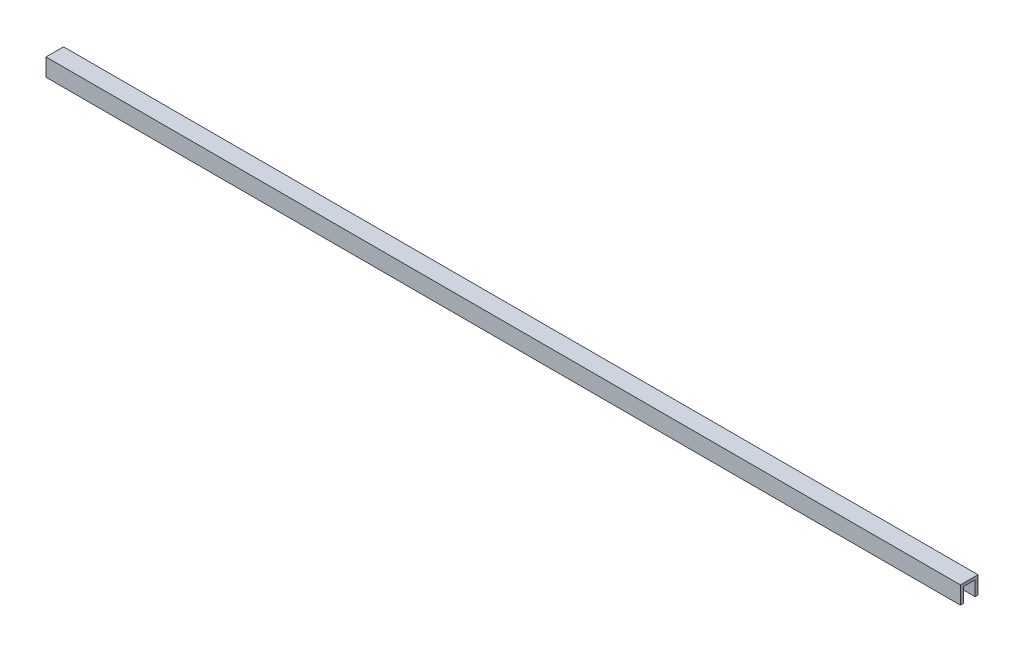
from build123d import *

# Parameters (mm, degrees)
BOSS_EXTRUDE1_DEPTH = 990.6


with BuildPart() as part:
    # Sketch1 → Boss-Extrude1 (new body)
    with BuildSketch(Plane(origin=(0, 0, 0), x_dir=(0, 0, -1), z_dir=(1, 0, 0))):
        Polygon((0, -19.05), (0, 0), (19.05, 0), (19.05, -19.05), (15.875, -19.05), (15.875, -3.175), (3.175, -3.175), (3.175, -19.05), align=None)
    extrude(amount=BOSS_EXTRUDE1_DEPTH)


solid = part.part
